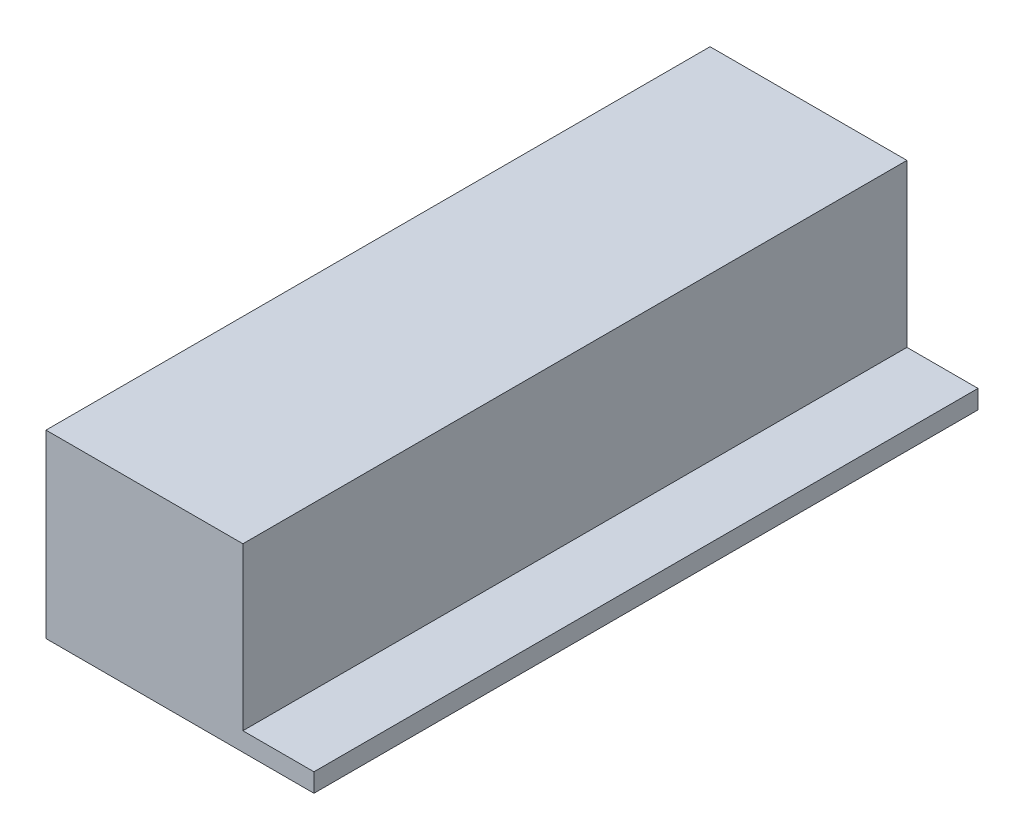
from build123d import *

# Parameters (mm, degrees)
BOSS_EXTRUDE1_DEPTH = 57


with BuildPart() as part:
    # Sketch1 → Boss-Extrude1 (new body)
    with BuildSketch(Plane.XY):
        Polygon((0, 0), (23, 0), (23, 1.6), (16.9, 1.6), (16.9, 15.5), (0, 15.5), align=None)
    extrude(amount=BOSS_EXTRUDE1_DEPTH)


solid = part.part
